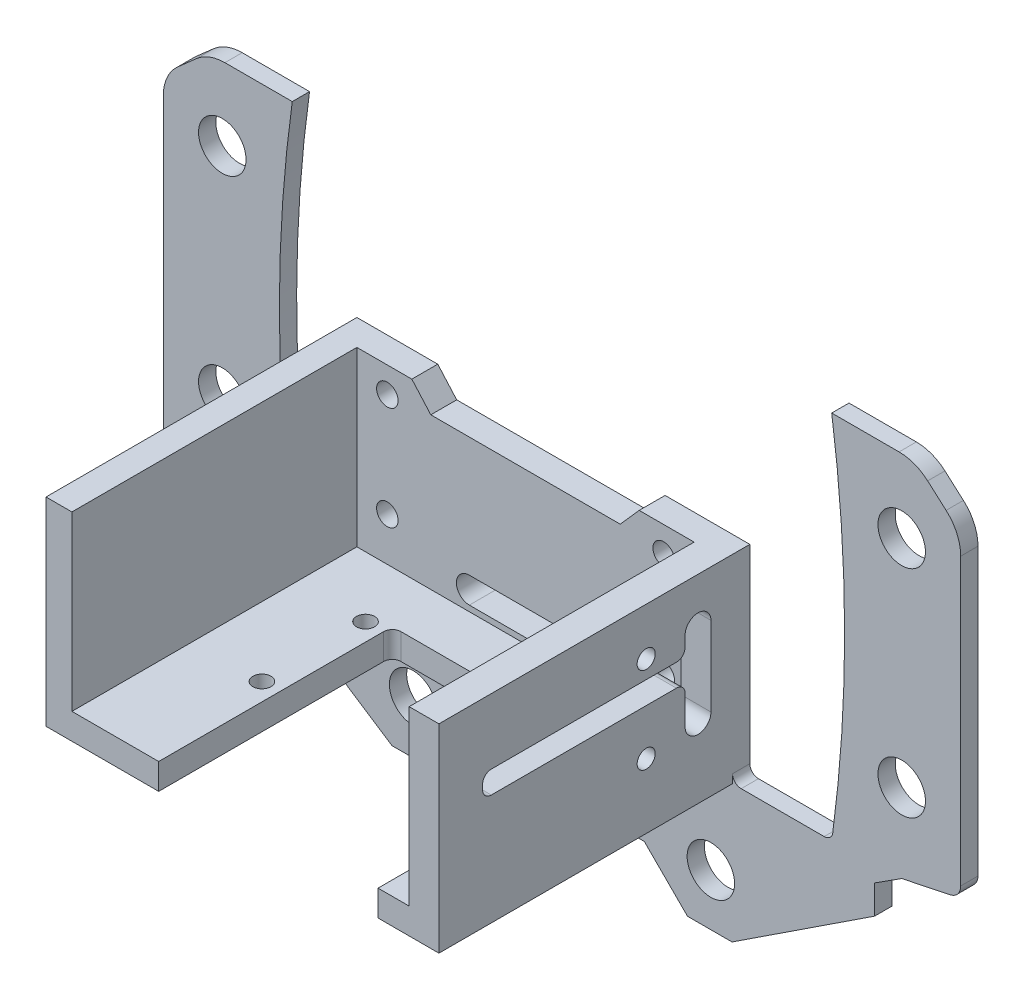
from build123d import *

# Parameters (mm, degrees)
SKETCH_1_R              = 2.75
EXTRUDE_1_DEPTH         = 2
SKETCH_2_R              = 1.05
EXTRUDE_13689_DEPTH     = 3
SKETCH_3_W              = 3
SKETCH_3_H              = 36
SKETCH_3_W_2            = 3.45
EXTRUDE_14140_DEPTH     = 20
CUT_EXTRUDE_14477_REACH = 157.33
SKETCH_5_R              = 1.05
SKETCH_6_R              = 1.245588001
EXTRUDE_15246_DEPTH     = 3
FILLET_1_R              = 1


with BuildPart() as part:
    # 草图1 → 凸台-拉伸1 (new body)
    with BuildSketch(Plane.XY):
        with BuildLine():
            Line((-31.232935168, 137.582300402), (-39.033457742, 137.582300402))
            ThreePointArc((-39.033457742, 137.582300402), (-40.802630101, 137.2588407), (-42.342900075, 136.330312067))
            Line((-42.342900075, 136.330312067), (-44.480254451, 134.443057788))
            ThreePointArc((-44.480254451, 134.443057788), (-45.728619247, 132.750865708), (-46.170812117, 130.695046123))
            Line((-46.170812117, 130.695046123), (-46.170812117, 97.620783931))
            ThreePointArc((-46.170812117, 97.620783931), (-45.830898888, 96.66237235), (-44.963075466, 96.132300402))
            Line((-44.963075466, 96.132300402), (-39.335406059, 94.947479812))
            Line((-39.335406059, 94.947479812), (-36.200029499, 92.942583722))
            Line((-36.200029499, 92.942583722), (-36.200029499, 89.608050871))
            Line((-36.200029499, 89.608050871), (-19.688242157, 78.763336754))
            Line((-19.688242157, 78.763336754), (-14.532154357, 78.763336754))
            Line((-14.532154357, 78.763336754), (-9.532154357, 83.763336754))
            Line((-9.532154357, 83.763336754), (9.532154357, 83.763336754))
            Line((9.532154357, 83.763336754), (14.532154357, 78.763336754))
            Line((14.532154357, 78.763336754), (19.688242157, 78.763336754))
            Line((19.688242157, 78.763336754), (36.200029499, 89.608050871))
            Line((36.200029499, 89.608050871), (36.200029499, 92.942583722))
            Line((36.200029499, 92.942583722), (39.335406059, 94.947479812))
            Line((39.335406059, 94.947479812), (44.963075466, 96.132300402))
            ThreePointArc((44.963075466, 96.132300402), (45.830898888, 96.66237235), (46.170812117, 97.620783931))
            Line((46.170812117, 97.620783931), (46.170812117, 130.695046123))
            ThreePointArc((46.170812117, 130.695046123), (45.728619247, 132.750865708), (44.480254451, 134.443057788))
            Line((44.480254451, 134.443057788), (42.342900075, 136.330312067))
            ThreePointArc((42.342900075, 136.330312067), (40.802630101, 137.2588407), (39.033457742, 137.582300402))
            Line((39.033457742, 137.582300402), (31.232935168, 137.582300402))
            ThreePointArc((31.232935168, 137.582300402), (32.726681953, 116.126426191), (31.232935168, 94.67055198))
            Line((31.232935168, 94.67055198), (-31.232935168, 94.67055198))
            ThreePointArc((-31.232935168, 94.67055198), (-32.726681953, 116.126426191), (-31.232935168, 137.582300402))
        make_face()
        with Locations((39.335406059, 129.082300402)):
            Circle(SKETCH_1_R, mode=Mode.SUBTRACT)
        with Locations((39.335406059, 104.082300402)):
            Circle(SKETCH_1_R, mode=Mode.SUBTRACT)
        with Locations((17.23796389, 84.763336754)):
            Circle(SKETCH_1_R, mode=Mode.SUBTRACT)
        with Locations(Location((-17.23796389, 84.763336754, 0), (0, 0, 180))):
            Circle(SKETCH_1_R, mode=Mode.SUBTRACT)
        with Locations(Location((-39.335406059, 104.082300402, 0), (0, 0, 180))):
            Circle(SKETCH_1_R, mode=Mode.SUBTRACT)
        with Locations(Location((-39.335406059, 129.082300402, 0), (0, 0, 180))):
            Circle(SKETCH_1_R, mode=Mode.SUBTRACT)
    extrude(amount=EXTRUDE_1_DEPTH)

    # 草图2 → Extrude 13689 (add)
    with BuildSketch(Plane(origin=(0, 94.67055198, 0), x_dir=(1, 0, 0), z_dir=(0, 1, 0))):
        Polygon((12.371090345, 0), (19.75, 0), (19.75, -36), (12.7, -36), (12.7, -8.95), (-12.7, -8.95), (-12.7, -36), (-25.75, -36), (-25.75, 0), (-12.371090345, 0), align=None)
        with Locations(Location((14.75, -10, 0), (0, 0, 270))):
            Circle(SKETCH_2_R, mode=Mode.SUBTRACT)
        with Locations(Location((-14.75, -10, 0), (0, 0, 90))):
            Circle(SKETCH_2_R, mode=Mode.SUBTRACT)
        with Locations(Location((-14.75, -22, 0), (0, 0, 270))):
            Circle(SKETCH_2_R, mode=Mode.SUBTRACT)
        with Locations(Location((14.75, -22, 0), (0, 0, 90))):
            Circle(SKETCH_2_R, mode=Mode.SUBTRACT)
    extrude(amount=EXTRUDE_13689_DEPTH)

    # 草图3 → Extrude 14140 (add)
    with BuildSketch(Plane(origin=(0, 97.67055198, 0), x_dir=(1, 0, 0), z_dir=(0, 1, 0))):
        with Locations((-24.25, -18)):
            Rectangle(SKETCH_3_W, SKETCH_3_H)
        with Locations((18.025, -18)):
            Rectangle(SKETCH_3_W_2, SKETCH_3_H)
    extrude(amount=EXTRUDE_14140_DEPTH)

    # 草图5 → Cut-Extrude 14477 (cut, up to next)
    with BuildSketch(Plane.ZY.offset(-16.3), mode=Mode.PRIVATE) as cut_extrude_14477_sk1:
        with Locations((12, 102.17055198)):
            Circle(SKETCH_5_R)
    cut_extrude_14477_tool1 = extrude(cut_extrude_14477_sk1.sketch, amount=-CUT_EXTRUDE_14477_REACH, mode=Mode.PRIVATE) & part.part
    # 草图5 → Cut-Extrude 14477 (cut, up to next)
    with BuildSketch(Plane.ZY.offset(-16.3), mode=Mode.PRIVATE) as cut_extrude_14477_sk2:
        with Locations((12, 112.17055198)):
            Circle(SKETCH_5_R)
    cut_extrude_14477_tool2 = extrude(cut_extrude_14477_sk2.sketch, amount=-CUT_EXTRUDE_14477_REACH, mode=Mode.PRIVATE) & part.part
    # 草图5 → Cut-Extrude 14477 (cut, up to next)
    with BuildSketch(Plane.ZY.offset(-16.3), mode=Mode.PRIVATE) as cut_extrude_14477_sk3:
        with BuildLine():
            Line((7.5, 112.298234054), (7.5, 110.096723462))
            Line((7.5, 110.096723462), (30.937767474, 110.096723462))
            Line((30.937767474, 110.096723462), (30.937767474, 107.500731647))
            Line((30.937767474, 107.500731647), (7.5, 107.500731647))
            Line((7.5, 107.500731647), (7.5, 103.107695613))
            ThreePointArc((7.5, 103.107695613), (6, 101.607695613), (4.5, 103.107695613))
            Line((4.5, 103.107695613), (4.5, 112.298234054))
            ThreePointArc((4.5, 112.298234054), (6, 113.798234054), (7.5, 112.298234054))
        make_face()
    cut_extrude_14477_tool3 = extrude(cut_extrude_14477_sk3.sketch, amount=-CUT_EXTRUDE_14477_REACH, mode=Mode.PRIVATE) & part.part
    add(cut_extrude_14477_tool1.solids().sort_by_distance((16.3, 102.170552, 12))[0], mode=Mode.SUBTRACT)
    add(cut_extrude_14477_tool2.solids().sort_by_distance((16.3, 112.170552, 12))[0], mode=Mode.SUBTRACT)
    add(cut_extrude_14477_tool3.solids().sort_by_distance((16.3, 108.401203, 14.423289))[0], mode=Mode.SUBTRACT)

    # 草图6 → Extrude 15246 (add)
    with BuildSketch(Plane(origin=(0, 0, 0), x_dir=(-1, 0, 0), z_dir=(0, 0, -1))):
        Polygon((-16.3, 117.67055198), (-9.937167199, 117.67055198), (-7.741837129, 115.189840313), (14.191837129, 115.189840313), (16.387167199, 117.67055198), (22.75, 117.67055198), (22.75, 97.67055198), (-16.3, 97.67055198), align=None)
        with Locations((-12.775, 114.69834671)):
            Circle(SKETCH_6_R, mode=Mode.SUBTRACT)
        with Locations((19.225, 114.69834671)):
            Circle(SKETCH_6_R, mode=Mode.SUBTRACT)
        with Locations((-12.775, 102.69834671)):
            Circle(SKETCH_6_R, mode=Mode.SUBTRACT)
        with Locations((19.225, 102.69834671)):
            Circle(SKETCH_6_R, mode=Mode.SUBTRACT)
        with BuildLine():
            Line((-3.280276477, 101.336740903), (9.730276477, 101.336740903))
            ThreePointArc((9.730276477, 101.336740903), (11.230276477, 99.836740903), (9.730276477, 98.336740903))
            Line((9.730276477, 98.336740903), (-3.280276477, 98.336740903))
            ThreePointArc((-3.280276477, 98.336740903), (-4.780276477, 99.836740903), (-3.280276477, 101.336740903))
        make_face(mode=Mode.SUBTRACT)
    extrude(amount=-EXTRUDE_15246_DEPTH)

    # 圆角1
    fillet_1_edges = [part.edges().sort_by_distance(p)[0] for p in [
        (19.75, 94.67055198, 1),
        (-25.75, 94.67055198, 1),
        (-12.7, 96.17055198, 8.95),
        (12.7, 96.17055198, 8.95),
        (18.025, 110.096723462, 7.5),
        (18.025, 110.096723462, 30.937767474),
        (18.025, 107.500731647, 30.937767474),
        (18.025, 107.500731647, 7.5),
        (-31.232935168, 94.67055198, 1),
        (31.232935168, 94.67055198, 1),
    ]]
    fillet(fillet_1_edges, radius=FILLET_1_R)


solid = part.part
